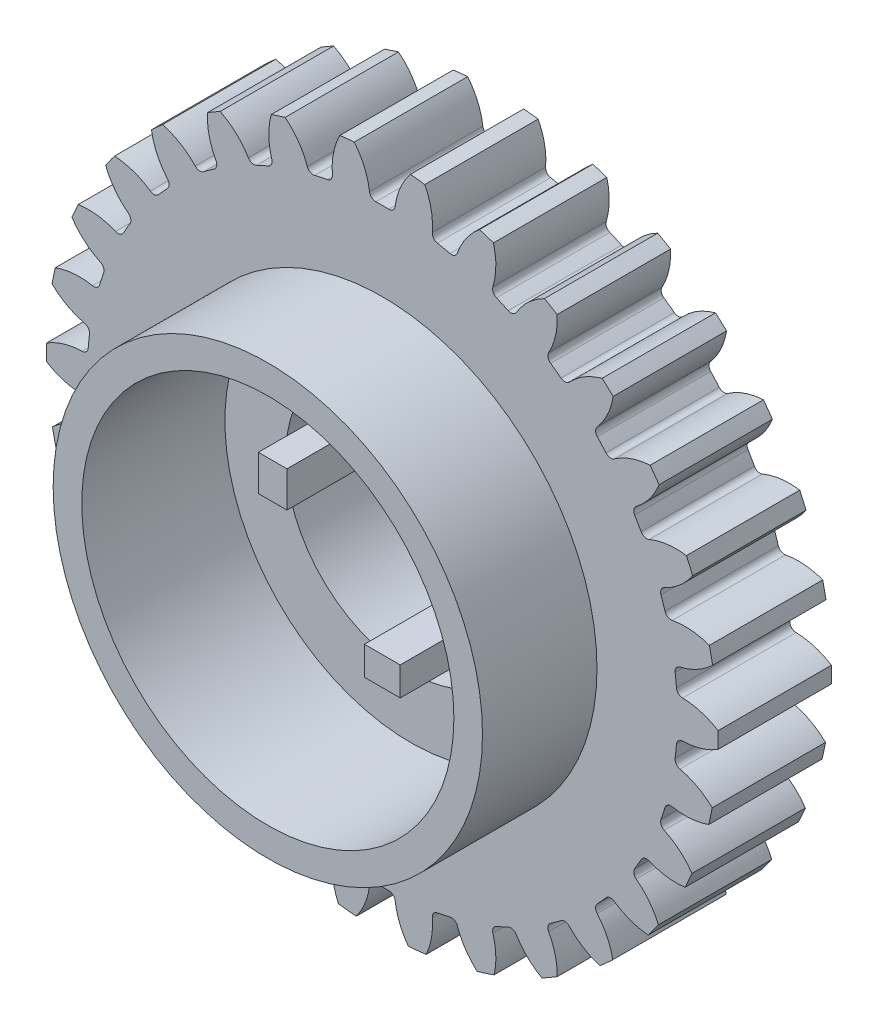
from build123d import *

# Parameters (mm, degrees)
SKETCH1_R                = 26.665
BOSS_EXTRUDE1_DEPTH      = 4.5
CUT_EXTRUDE1_DEPTH       = 8.335
FILLET1_R                = 0.5
CIRPATTERN1_COUNT        = 30
FILLET1_OF_CIRPATTERN1_R = 0.5
SCALE1_SCALE             = 0.88
SKETCH3_R                = 8.75
CUT_EXTRUDE2_DEPTH       = 25
BOSS_EXTRUDE3_START      = 3.96
SKETCH5_R                = 15
BOSS_EXTRUDE3_DEPTH      = 8
SKETCH6_R                = 13
CUT_EXTRUDE4_DEPTH       = 10
SKETCH4_W                = 2
SKETCH4_H                = 2.5
BOSS_EXTRUDE4_DEPTH      = 8
SKETCH4_W_2              = 2.5
SKETCH4_H_2              = 2
BOSS_EXTRUDE4_2_DEPTH    = 8
BOSS_EXTRUDE4_3_DEPTH    = 8
BOSS_EXTRUDE4_4_DEPTH    = 8


with BuildPart() as part:
    # Sketch1 → Boss-Extrude1 (new, symmetric)
    with BuildSketch(Plane.XY):
        Circle(SKETCH1_R)
    extrude(amount=BOSS_EXTRUDE1_DEPTH, both=True)

    # Sketch2 → Cut-Extrude1 (cut, symmetric)
    with BuildSketch(Plane.XY):
        with BuildLine():
            ThreePointArc((0.980310331, 23.309394923), (0, 23.33), (-0.980310331, 23.309394923))
            ThreePointArc((-0.980310331, 23.309394923), (-1.606891498, 25.641377876), (-3.168766736, 27.48292456))
            ThreePointArc((-3.168766736, 27.48292456), (0, 27.665), (3.168766736, 27.48292456))
            ThreePointArc((3.168766736, 27.48292456), (1.606891498, 25.641377876), (0.980310331, 23.309394923))
        make_face()
    cut_extrude1 = extrude(amount=CUT_EXTRUDE1_DEPTH, both=True, mode=Mode.SUBTRACT)

    # Fillet1
    fillet1_edges = [part.edges().sort_by_distance(p)[0] for p in [
        (0.980310331, 23.309394923, 0),
        (-0.980310331, 23.309394923, 0),
    ]]
    fillet(fillet1_edges, radius=FILLET1_R)

    # CirPattern1: Cut-Extrude1 ×30 about axis
    cirpattern1_axis = Axis((0, -0.105317808, 0), (0, 0, 1))
    for i in range(1, CIRPATTERN1_COUNT):
        add(cut_extrude1.rotate(cirpattern1_axis, i * 360 / CIRPATTERN1_COUNT), mode=Mode.SUBTRACT)

    # Fillet1 of CirPattern1
    fillet1_of_cirpattern1_edges = [part.edges().sort_by_distance(p)[0] for p in [
        (-3.909304315, 23.00154525, 0),
        (-5.827080712, 22.593909293, 0),
        (-8.628063605, 21.683814782, 0),
        (-10.419179705, 20.886358516, 0),
        (-12.969735112, 19.413794665, 0),
        (-14.555910547, 18.261370754, 0),
        (-16.74456696, 16.290695669, 0),
        (-18.056478252, 14.833670569, 0),
        (-19.787580882, 12.451012208, 0),
        (-20.767891213, 10.753064907, 0),
        (-21.965782568, 8.062556872, 0),
        (-22.571647672, 6.197895816, 0),
        (-23.183974152, 3.31712622, 0),
        (-23.388914817, 1.367246043, 0),
        (-23.388914817, -1.577881659, 0),
        (-23.183974152, -3.527761836, 0),
        (-22.571647672, -6.408531432, 0),
        (-21.965782568, -8.273192489, 0),
        (-20.767891213, -10.963700523, 0),
        (-19.787580882, -12.661647824, 0),
        (-18.056478252, -15.044306185, 0),
        (-16.74456696, -16.501331285, 0),
        (-14.555910547, -18.47200637, 0),
        (-12.969735112, -19.624430281, 0),
        (-10.419179705, -21.096994132, 0),
        (-8.628063605, -21.894450399, 0),
        (-5.827080712, -22.804544909, 0),
        (-3.909304315, -23.212180866, 0),
        (-0.980310331, -23.520030539, 0),
        (0.980310331, -23.520030539, 0),
        (3.909304315, -23.212180866, 0),
        (5.827080712, -22.804544909, 0),
        (8.628063605, -21.894450399, 0),
        (10.419179705, -21.096994132, 0),
        (12.969735112, -19.624430281, 0),
        (14.555910547, -18.47200637, 0),
        (16.74456696, -16.501331285, 0),
        (18.056478252, -15.044306185, 0),
        (19.787580882, -12.661647824, 0),
        (20.767891213, -10.963700523, 0),
        (21.965782568, -8.273192489, 0),
        (22.571647672, -6.408531432, 0),
        (23.183974152, -3.527761836, 0),
        (23.388914817, -1.577881659, 0),
        (23.388914817, 1.367246043, 0),
        (23.183974152, 3.31712622, 0),
        (22.571647672, 6.197895816, 0),
        (21.965782568, 8.062556872, 0),
        (20.767891213, 10.753064907, 0),
        (19.787580882, 12.451012208, 0),
        (18.056478252, 14.833670569, 0),
        (16.74456696, 16.290695669, 0),
        (14.555910547, 18.261370754, 0),
        (12.969735112, 19.413794665, 0),
        (10.419179705, 20.886358516, 0),
        (8.628063605, 21.683814782, 0),
        (5.827080712, 22.593909293, 0),
        (3.909304315, 23.00154525, 0),
    ]]
    fillet(fillet1_of_cirpattern1_edges, radius=FILLET1_OF_CIRPATTERN1_R)


with BuildPart() as part_1:
    # Scale1: scaled about (0, -0.077668509, 0)
    add(part.part.scale(SCALE1_SCALE).moved(Location((0, -0.009320221, 0))))

    # Sketch3 → Cut-Extrude2 (cut, symmetric)
    with BuildSketch(Plane.XY.offset(4.5)):
        Circle(SKETCH3_R)
    extrude(amount=CUT_EXTRUDE2_DEPTH, both=True, mode=Mode.SUBTRACT)

    # Sketch5 → Boss-Extrude3 (add)
    with BuildSketch(Plane.XY.offset(BOSS_EXTRUDE3_START)):
        Circle(SKETCH5_R)
    extrude(amount=BOSS_EXTRUDE3_DEPTH)

    # Sketch6 → Cut-Extrude4 (cut)
    with BuildSketch(Plane.XY.offset(11.96)):
        Circle(SKETCH6_R)
    extrude(amount=-CUT_EXTRUDE4_DEPTH, mode=Mode.SUBTRACT)


with BuildPart() as body_2:
    # Sketch4 → Boss-Extrude4 (new body)
    with BuildSketch(Plane.XY.offset(3.96)):
        with Locations((-7.660254038, 0)):
            Rectangle(SKETCH4_W, SKETCH4_H)
    extrude(amount=-BOSS_EXTRUDE4_DEPTH)


with BuildPart() as body_3:
    # Sketch4 → Boss-Extrude4 2 (new body)
    with BuildSketch(Plane.XY.offset(3.96)):
        with Locations((0, -7.660254038)):
            Rectangle(SKETCH4_W_2, SKETCH4_H_2)
    extrude(amount=-BOSS_EXTRUDE4_2_DEPTH)


with BuildPart() as body_4:
    # Sketch4 → Boss-Extrude4 3 (new body)
    with BuildSketch(Plane.XY.offset(3.96)):
        with Locations((0, 7.660254038)):
            Rectangle(SKETCH4_W_2, SKETCH4_H_2)
    extrude(amount=-BOSS_EXTRUDE4_3_DEPTH)


with BuildPart() as body_5:
    # Sketch4 → Boss-Extrude4 4 (new body)
    with BuildSketch(Plane.XY.offset(3.96)):
        with Locations((7.660254038, 0)):
            Rectangle(SKETCH4_W, SKETCH4_H)
    extrude(amount=-BOSS_EXTRUDE4_4_DEPTH)


solid = Compound([part_1.part, body_2.part, body_3.part, body_4.part, body_5.part])
